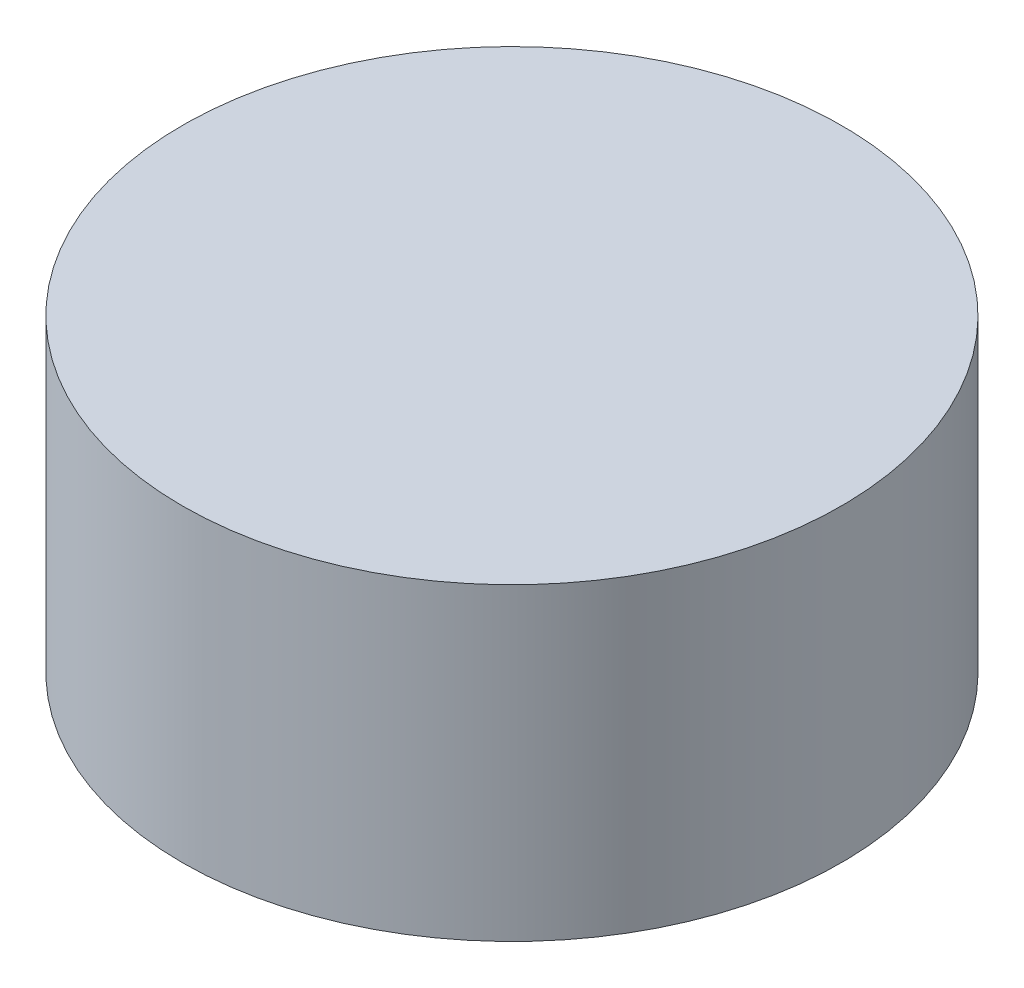
from build123d import *

# Parameters (mm, degrees)
KOLA1L_KAPAK_D32_START = 265
SKETCH1_R              = 16
KOLA1L_KAPAK_D32_DEPTH = 15


with BuildPart() as part:
    # Sketch1 → KOLA1L_kapak_D32 (new body)
    with BuildSketch(Plane(origin=(0, 0, 0), x_dir=(1, 0, 0), z_dir=(0, 1, 0)).offset(KOLA1L_KAPAK_D32_START)):
        with Locations(Location((0, 0, 0), (0, 0, 270))):
            Circle(SKETCH1_R)
    extrude(amount=KOLA1L_KAPAK_D32_DEPTH)


solid = part.part
